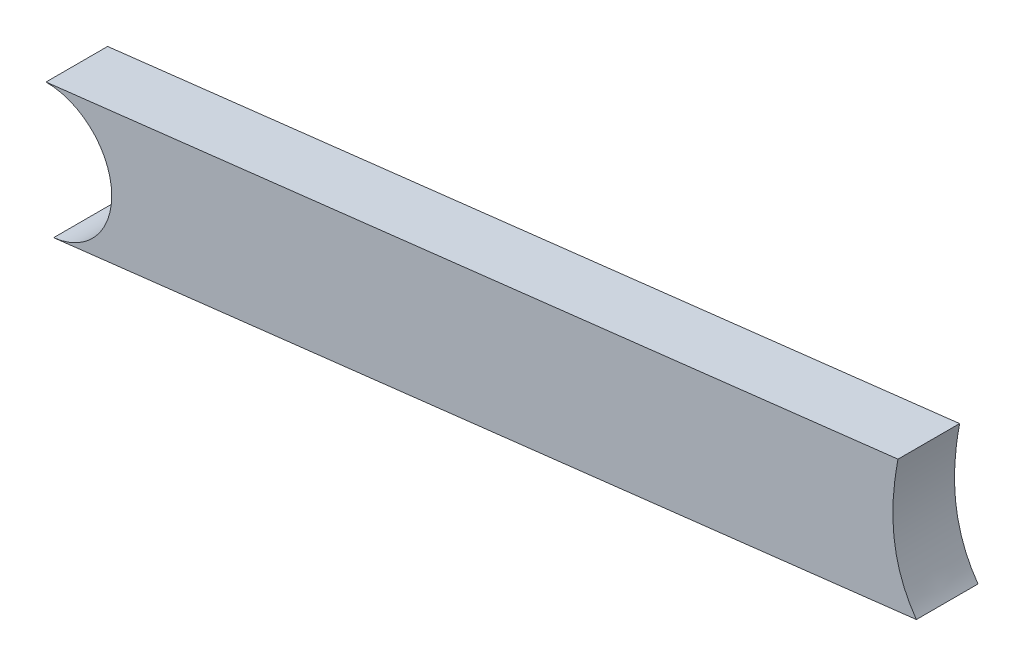
from build123d import *

# Parameters (mm, degrees)
BOSS_EXTRUDE1_DEPTH = 3


with BuildPart() as part:
    # Sketch1 → Boss-Extrude1 (new body)
    with BuildSketch(Plane.XY):
        with BuildLine():
            Line((0, 50.4744), (41.483730448, 55.313784486))
            add(Edge.make_bspline(
                [(42.379075966, 48.996532434), (40.859759265, 51.112442987), (41.189355998, 53.710666555), (41.483730448, 55.313784486)],
                knots=[0, 0, 0, 0, 1, 1, 1, 1], degree=3))
            Line((42.379075966, 48.996532434), (0.370789207, 44.095954568))
            ThreePointArc((0.370789207, 44.095954568), (3.194606813, 47.46010759), (0, 50.4744))
        make_face()
    extrude(amount=-BOSS_EXTRUDE1_DEPTH)


solid = part.part
